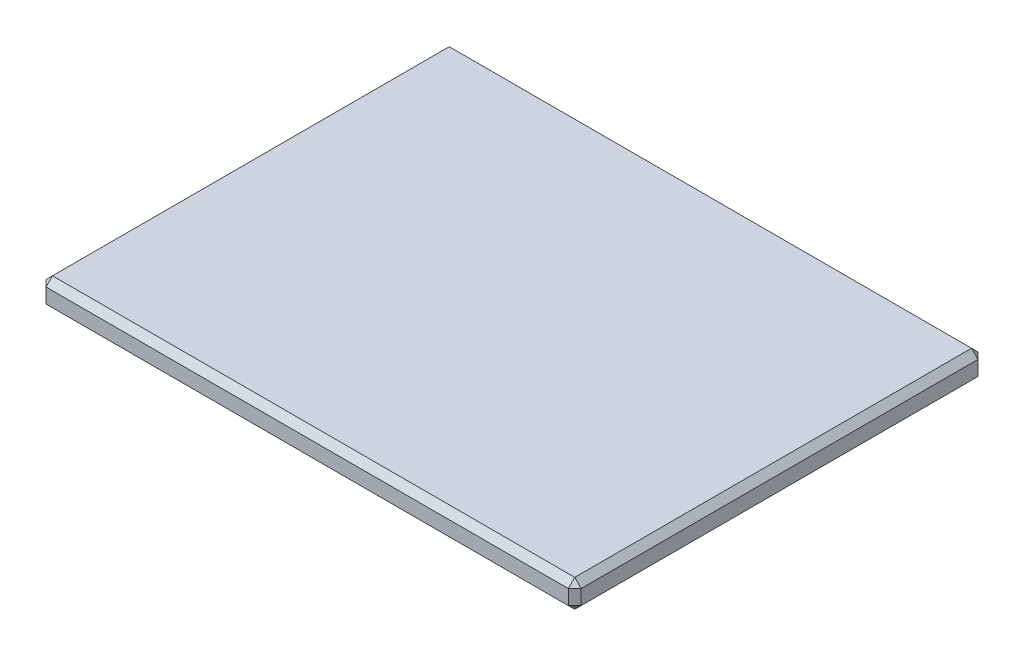
from build123d import *

# Parameters (mm, degrees)
SKETCH1_W           = 73.66
SKETCH1_H           = 56.388
BOSS_EXTRUDE1_DEPTH = 3.81
CHAMFER1_SIZE       = 0.889


with BuildPart() as part:
    # Sketch1 → Boss-Extrude1 (new body)
    with BuildSketch(Plane(origin=(0, 0, 0), x_dir=(1, 0, 0), z_dir=(0, 1, 0))):
        Rectangle(SKETCH1_W, SKETCH1_H)
    extrude(amount=-BOSS_EXTRUDE1_DEPTH)

    # Chamfer1
    chamfer1_edges = [part.edges().sort_by_distance(p)[0] for p in [
        (-36.83, -3.81, 0),
        (0, -3.81, 28.194),
        (36.83, -3.81, 0),
        (0, 0, 28.194),
        (-36.83, 0, 0),
        (0, 0, -28.194),
        (36.83, 0, 0),
        (0, -3.81, -28.194),
        (36.83, -1.905, 28.194),
        (-36.83, -1.905, 28.194),
        (-36.83, -1.905, -28.194),
        (36.83, -1.905, -28.194),
    ]]
    chamfer(chamfer1_edges, length=CHAMFER1_SIZE)


solid = part.part
